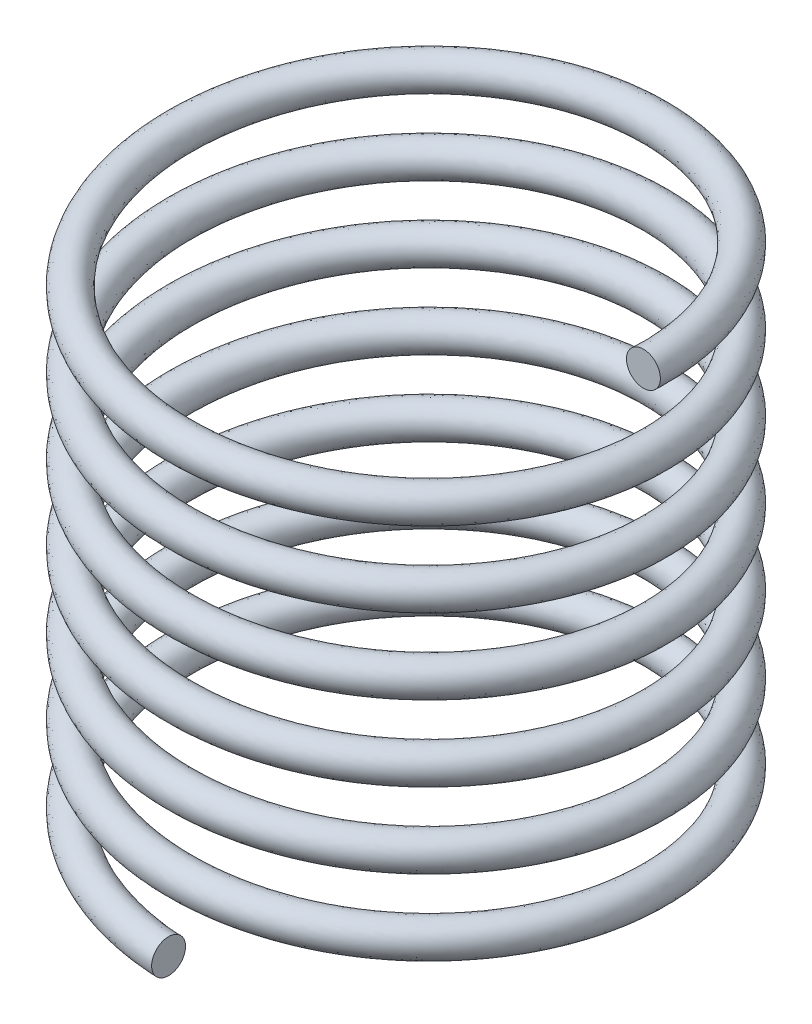
from build123d import *

# Parameters (mm, degrees)
SWEEP1_PITCH  = 1.111111111
SWEEP1_HEIGHT = 7.5
SWEEP1_RADIUS = 3.5
SKETCH3_R     = 0.25


with BuildPart() as part:
    # Sweep1: sweep along a helix
    with BuildLine() as sweep1_path:
        Helix(SWEEP1_PITCH, SWEEP1_HEIGHT, SWEEP1_RADIUS, center=(0, 0, 0), direction=(0, 1, 0), lefthand=True)
    # Sketch3 → Sweep1 (sweep)
    with BuildSketch(Plane(origin=(0, 0, 0), x_dir=(0, 0, -1), z_dir=(1, 0, 0))):
        with Locations((-3.5, 0)):
            Circle(SKETCH3_R)
    sweep(path=sweep1_path.line, is_frenet=True)


solid = part.part
